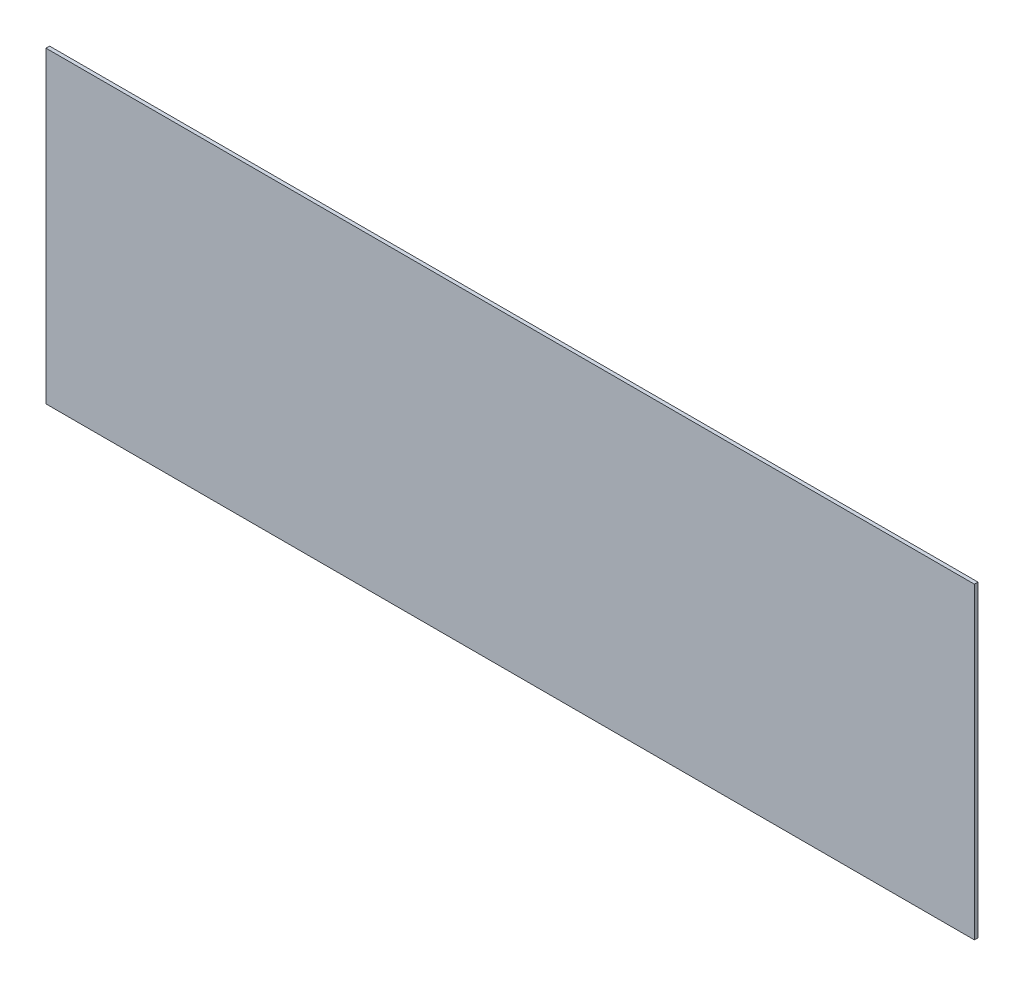
from build123d import *

# Parameters (mm, degrees)
SKETCH1_W           = 513.17
SKETCH1_H           = 170.3
BOSS_EXTRUDE1_DEPTH = 2


with BuildPart() as part:
    # Sketch1 → Boss-Extrude1 (new body)
    with BuildSketch(Plane.XY):
        with Locations((-66.700757687, 41.784360355)):
            Rectangle(SKETCH1_W, SKETCH1_H)
    extrude(amount=BOSS_EXTRUDE1_DEPTH)


solid = part.part
